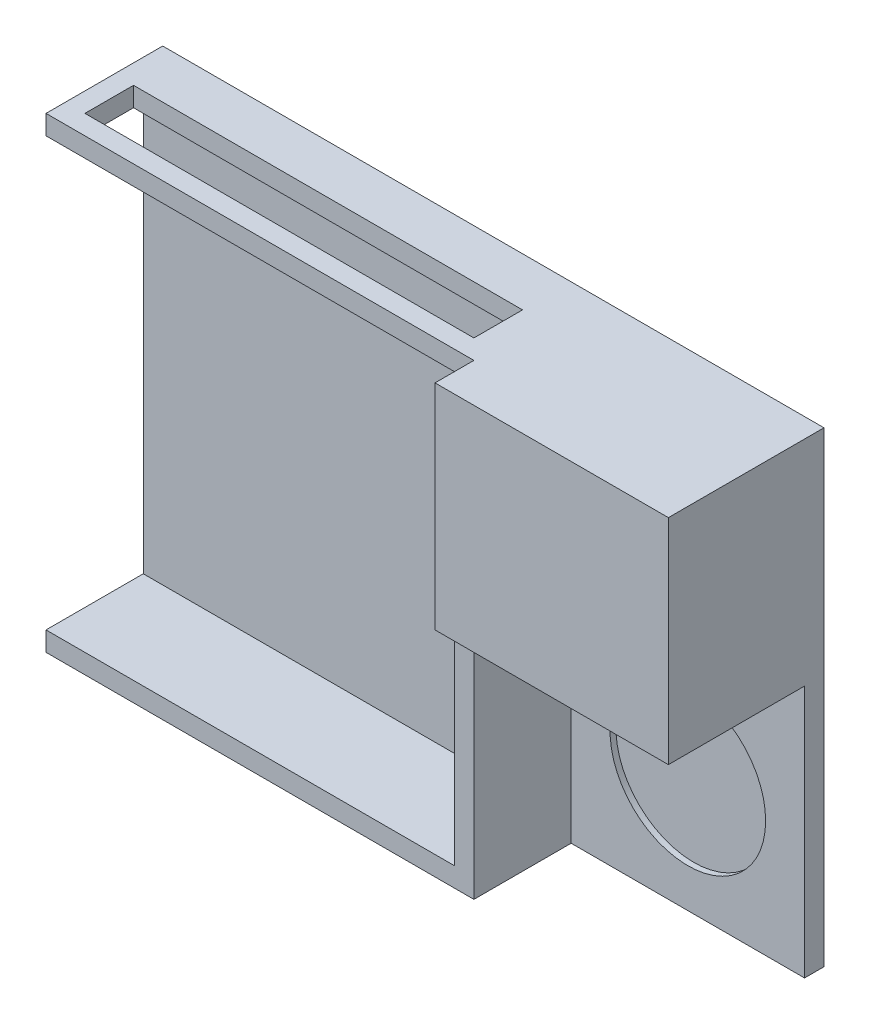
from build123d import *

# Parameters (mm, degrees)
RESSALTO_EXTRUS_O1_DEPTH   = 10
ESBO_O2_W                  = 10
ESBO_O2_H                  = 10
ESBO_O2_W_2                = 210
ESBO_O2_H_2                = 220
RESSALTO_EXTRUS_O4_DEPTH   = 50
ESBO_O7_R                  = 40
CORTE_EXTRUS_O1_DEPTH      = 3
ESBO_O21_W                 = 200
ESBO_O21_H                 = 25
CORTE_EXTRUS_O5_DEPTH      = 100
CORTE_EXTRUS_O6_DEPTH      = 161.25
CORTE_EXTRUS_O6_DEPTH_BACK = 1.25
ESBO_O23_W                 = 150
ESBO_O23_H                 = 5
RESSALTO_EXTRUS_O5_DEPTH   = 70


with BuildPart() as part:
    # Esboço1 → Ressalto-extrusão1 (new body)
    with BuildSketch(Plane.XY):
        Polygon((-99.217703787, 25.02394247), (70.782296213, 25.02394247), (70.782296213, 0), (70.782296213, -214.97605753), (-99.217703787, -214.97605753), (-269.217703787, -214.97605753), (-269.217703787, 0), (-269.217703787, 25.02394247), align=None)
    extrude(amount=RESSALTO_EXTRUS_O1_DEPTH)

    # Esboço2 → Ressalto-extrusão4 (add)
    with BuildSketch(Plane.XY.offset(10)):
        with Locations((-54.217703787, -209.97605753)):
            Rectangle(ESBO_O2_W, ESBO_O2_H)
        with Locations((-164.217703787, -209.97605753)):
            Rectangle(ESBO_O2_W_2, ESBO_O2_H)
        with Locations((-54.217703787, -94.97605753)):
            Rectangle(ESBO_O2_W, ESBO_O2_H_2)
        Polygon((-59.217703787, 15.02394247), (-49.217703787, 15.02394247), (-49.217703787, 25.02394247), (-269.217703787, 25.02394247), (-269.217703787, 15.02394247), align=None)
    extrude(amount=RESSALTO_EXTRUS_O4_DEPTH)

    # Esboço7 → Corte-extrusão1 (cut)
    with BuildSketch(Plane.XY.offset(10)):
        with Locations((10.782296213, -154.97605753)):
            Circle(ESBO_O7_R)
    extrude(amount=-CORTE_EXTRUS_O1_DEPTH, mode=Mode.SUBTRACT)

    # Esboço21 → Corte-extrusão5 (cut)
    with BuildSketch(Plane(origin=(0, 25.02394247, 0), x_dir=(1, 0, 0), z_dir=(0, 1, 0))):
        with Locations((-159.217703787, -37.5)):
            Rectangle(ESBO_O21_W, ESBO_O21_H)
    extrude(amount=-CORTE_EXTRUS_O5_DEPTH, mode=Mode.SUBTRACT)

    # Esboço23 → Corte-extrusão6 (cut, two sides: drawn at the far end of the back side and taken through both)
    with BuildSketch(Plane.XZ.offset(-15.02394247).offset(-CORTE_EXTRUS_O6_DEPTH_BACK)):
        with Locations((-194.217703787, 55)):
            Rectangle(ESBO_O23_W, ESBO_O23_H)
    extrude(amount=CORTE_EXTRUS_O6_DEPTH + CORTE_EXTRUS_O6_DEPTH_BACK, mode=Mode.SUBTRACT)

    # Esboço28 → Ressalto-extrusão5 (add)
    with BuildSketch(Plane.XY.offset(10)):
        Polygon((70.782296213, -84.97605753), (70.782296213, 25.02394247), (60.782296213, 25.02394247), (-39.217703787, 25.02394247), (-49.217703787, 25.02394247), (-49.217703787, -74.97605753), (-49.217703787, -84.97605753), align=None)
    extrude(amount=RESSALTO_EXTRUS_O5_DEPTH)


solid = part.part
